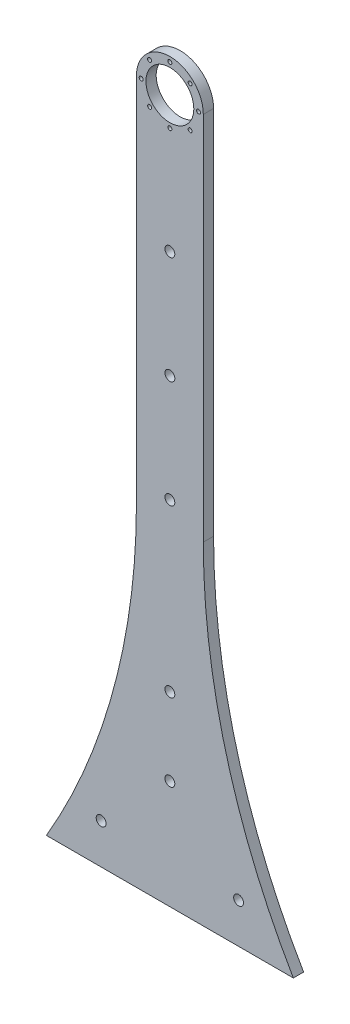
from build123d import *

# Parameters (mm, degrees)
SKETCH2_R           = 12.6
BOSS_EXTRUDE1_DEPTH = 5.4
SKETCH3_R           = 1.05
SKETCH3_R_2         = 2.6
CUT_EXTRUDE1_DEPTH  = 413.785561763


with BuildPart() as part:
    # Sketch2 → Boss-Extrude1 (new body)
    with BuildSketch(Plane.XY):
        with BuildLine():
            Line((-65, 20), (65, 20))
            ThreePointArc((65, 20), (29.659714989, 104.34714566), (17.6, 195))
            Line((17.6, 195), (17.6, 390))
            ThreePointArc((17.6, 390), (0, 407.6), (-17.6, 390))
            Line((-17.6, 390), (-17.6, 195))
            ThreePointArc((-17.6, 195), (-29.659714989, 104.34714566), (-65, 20))
        make_face()
        with Locations((0, 390)):
            Circle(SKETCH2_R, mode=Mode.SUBTRACT)
    extrude(amount=-BOSS_EXTRUDE1_DEPTH)

    # Sketch3 → Cut-Extrude1 (cut, through all)
    with BuildSketch(Plane(origin=(0, 0, -5.4), x_dir=(-1, 0, 0), z_dir=(0, 0, -1))):
        with Locations((10.677312396, 400.677312396)):
            Circle(SKETCH3_R)
        with Locations((0, 405.1)):
            Circle(SKETCH3_R)
        with Locations((-10.677312396, 400.677312396)):
            Circle(SKETCH3_R)
        with Locations((-15.1, 390)):
            Circle(SKETCH3_R)
        with Locations((-10.677312396, 379.322687604)):
            Circle(SKETCH3_R)
        with Locations((0, 374.9)):
            Circle(SKETCH3_R)
        with Locations((10.677312396, 379.322687604)):
            Circle(SKETCH3_R)
        with Locations((15.1, 390)):
            Circle(SKETCH3_R)
        with Locations((0, 262.1)):
            Circle(SKETCH3_R_2)
        with Locations((0, 318.7)):
            Circle(SKETCH3_R_2)
        with Locations((-36.174923221, 41.087461611)):
            Circle(SKETCH3_R_2)
        with Locations((36.174923221, 41.087461611)):
            Circle(SKETCH3_R_2)
        with Locations((0, 77.262384832)):
            Circle(SKETCH3_R_2)
        with Locations((0, 117.98239975)):
            Circle(SKETCH3_R_2)
        with Locations((0, 205.5)):
            Circle(SKETCH3_R_2)
    extrude(amount=-CUT_EXTRUDE1_DEPTH, mode=Mode.SUBTRACT)


solid = part.part
